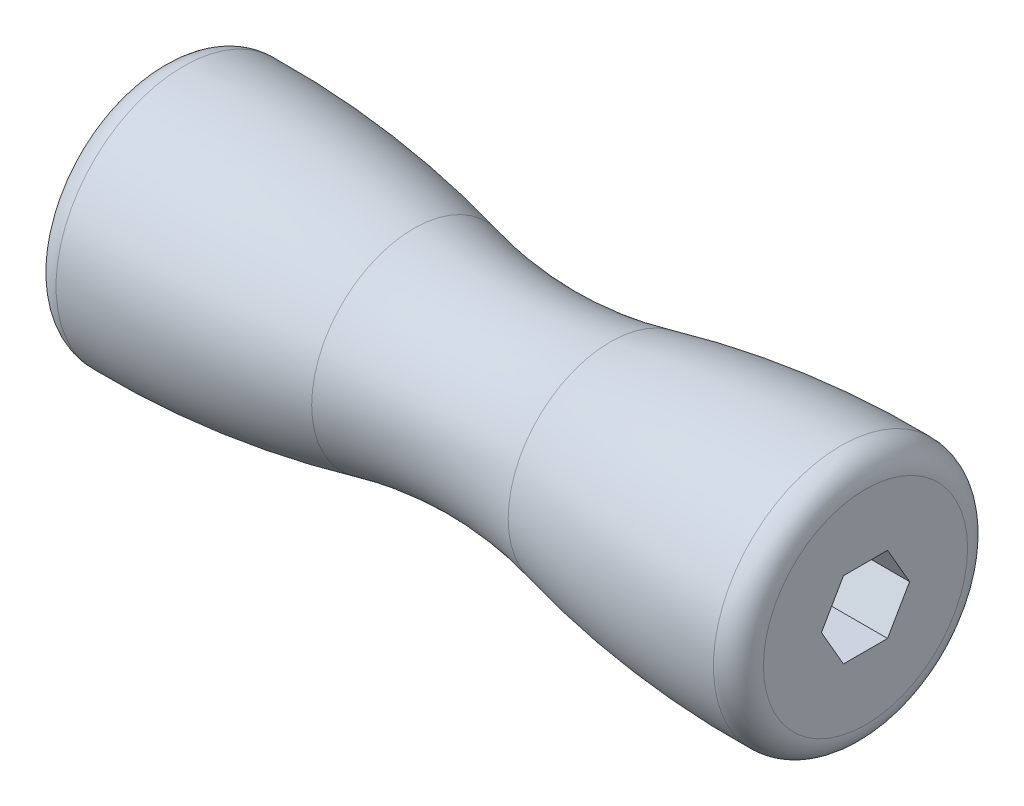
from build123d import *

# Parameters (mm, degrees)
CUT_EXTRUDE1_DEPTH = 52.59692143


with BuildPart() as part:
    # Sketch2 → Revolve1 (revolve)
    with BuildSketch(Plane.XY):
        with BuildLine():
            Line((-25, 0), (-25, 7.218127455))
            ThreePointArc((-25, 7.218127455), (-24.486963528, 8.469250598), (-23.243251097, 9))
            ThreePointArc((-23.243251097, 9), (-15.040879193, 8.611248064), (-6.94833646, 7.218127455))
            ThreePointArc((-6.94833646, 7.218127455), (0, 6.408356031), (6.94833646, 7.218127455))
            ThreePointArc((6.94833646, 7.218127455), (15.040879193, 8.611248064), (23.243251097, 9))
            ThreePointArc((23.243251097, 9), (24.486963528, 8.469250598), (25, 7.218127455))
            Line((25, 7.218127455), (25, 0))
            Line((25, 0), (-25, 0))
        make_face()
    revolve(axis=Axis((25, 0, 0), (-1, 0, 0)))

    # Sketch3 → Cut-Extrude1 (cut, through all)
    with BuildSketch(Plane(origin=(25, 0, 0), x_dir=(0, 0, -1), z_dir=(1, 0, 0))):
        Polygon((3.117691454, 0), (1.558845727, 2.7), (-1.558845727, 2.7), (-3.117691454, 0), (-1.558845727, -2.7), (1.558845727, -2.7), align=None)
    extrude(amount=-CUT_EXTRUDE1_DEPTH, mode=Mode.SUBTRACT)


solid = part.part
